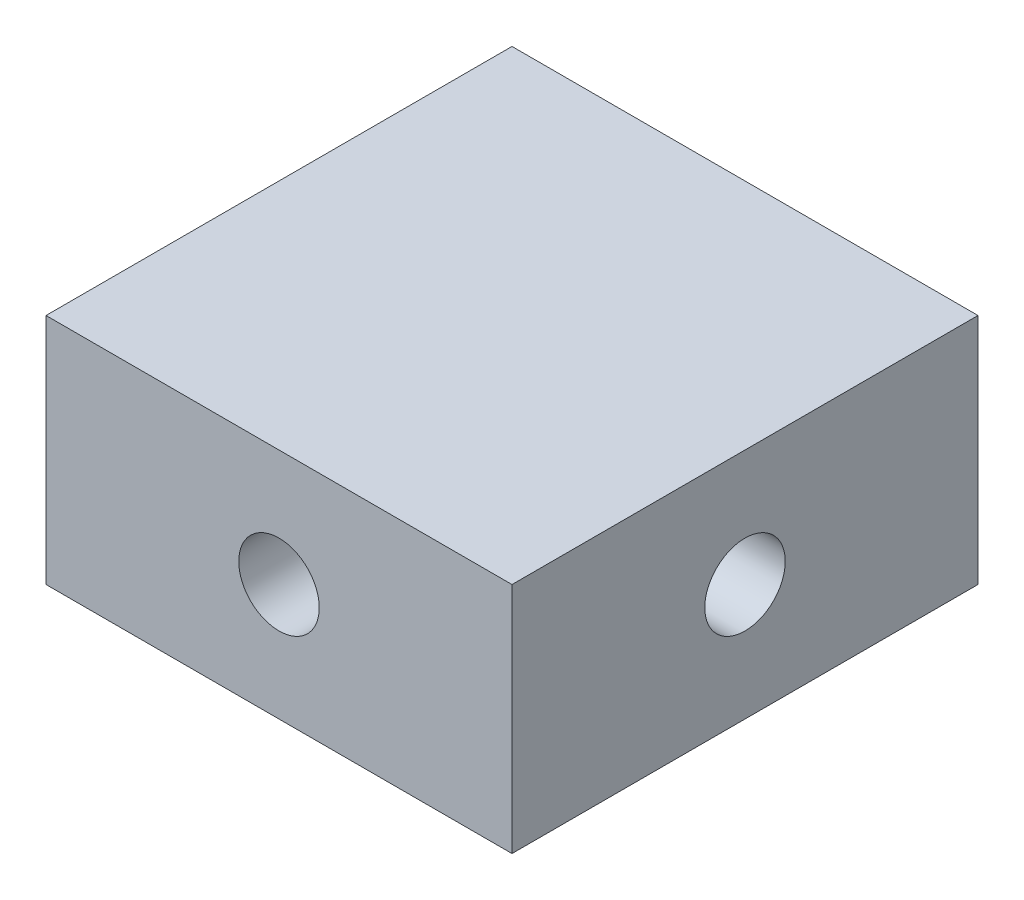
from build123d import *

# Parameters (mm, degrees)
SKETCH1_W           = 20
SKETCH1_H           = 20
BOSS_EXTRUDE1_DEPTH = 5
CIRPATTERN1_COUNT   = 4


with BuildPart() as part:
    # Sketch1 → Boss-Extrude1 (new, symmetric)
    with BuildSketch(Plane(origin=(0, 0, 0), x_dir=(1, 0, 0), z_dir=(0, 1, 0))):
        Rectangle(SKETCH1_W, SKETCH1_H)
    extrude(amount=BOSS_EXTRUDE1_DEPTH, both=True)

    # Sketch3 → #8-32 Tapped Hole1 (revolve, cut)
    with BuildSketch(Plane(origin=(10, 0, 0), x_dir=(0, 0, -1), z_dir=(0, 1, 0))):
        Polygon((0, 0), (0, 7.387806461), (1.7272, 6.35), (1.7272, 0), align=None)
    f_8_32_tapped_hole1 = revolve(axis=Axis((16.35, 0, 0), (-1, 0, 0)), mode=Mode.SUBTRACT)

    # CirPattern1: #8-32 Tapped Hole1 ×4 about axis
    cirpattern1_axis = Axis((0, 0, 0), (0, 1, 0))
    for i in range(1, CIRPATTERN1_COUNT):
        add(f_8_32_tapped_hole1.rotate(cirpattern1_axis, i * 360 / CIRPATTERN1_COUNT), mode=Mode.SUBTRACT)


solid = part.part
